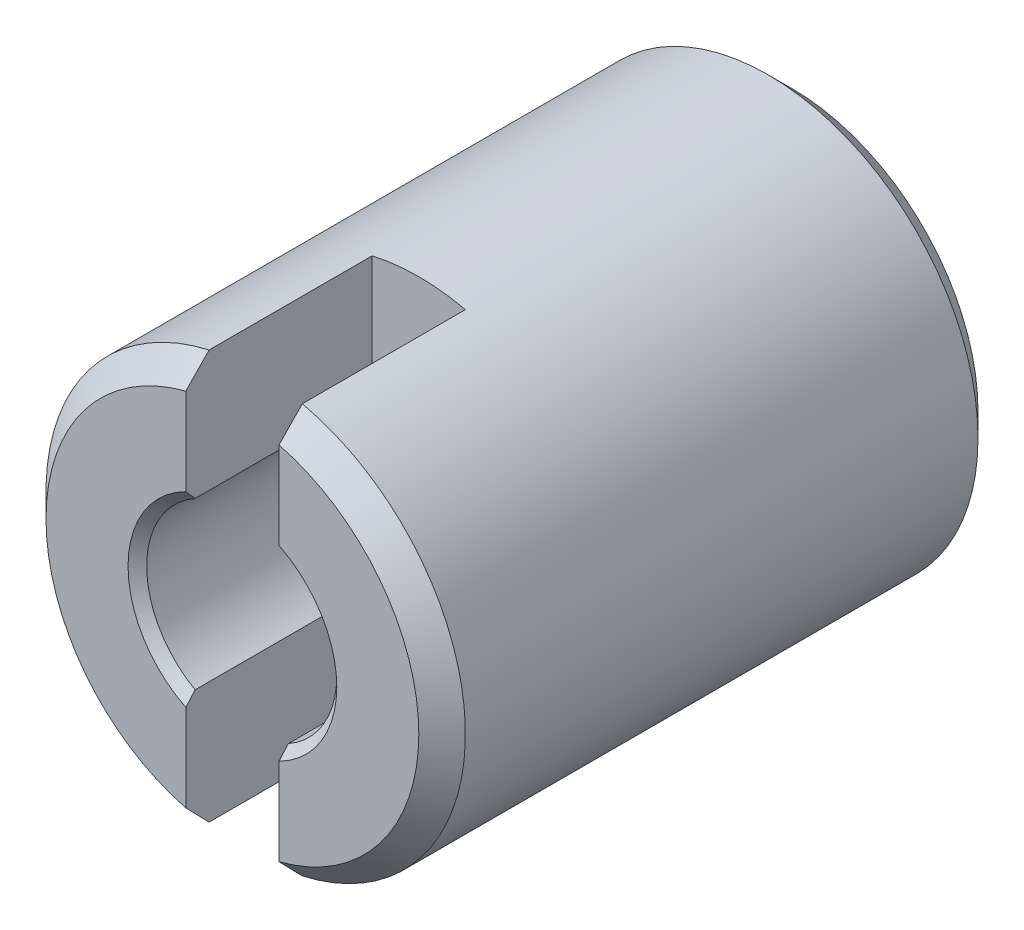
from build123d import *

# Parameters (mm, degrees)
SKETCH_1_R          = 2.25
EXTRUDE_1_DEPTH     = 6
SKETCH_2_R          = 1.02
CUT_EXTRUDE_1_DEPTH = 6
SKETCH_3_W          = 1
SKETCH_3_H          = 5
CUT_EXTRUDE_2_DEPTH = 2
CHAMFER_1_SIZE      = 0.25
CHAMFER_2_SIZE      = 0.25
CHAMFER_4_SIZE      = 0.25
CHAMFER_5_SIZE      = 0.1
CHAMFER_6_SIZE      = 0.1
CHAMFER_7_SIZE      = 0.1


with BuildPart() as part:
    # Эскиз1 → Бобышка-Вытянуть1 (new body)
    with BuildSketch(Plane.XY):
        Circle(SKETCH_1_R)
    extrude(amount=EXTRUDE_1_DEPTH)

    # Эскиз2 → Вырез-Вытянуть1 (cut)
    with BuildSketch(Plane.XY.offset(6)):
        Circle(SKETCH_2_R)
    extrude(amount=-CUT_EXTRUDE_1_DEPTH, mode=Mode.SUBTRACT)

    # Эскиз3 → Вырез-Вытянуть2 (cut)
    with BuildSketch(Plane.XY.offset(6)):
        Rectangle(SKETCH_3_W, SKETCH_3_H)
    extrude(amount=-CUT_EXTRUDE_2_DEPTH, mode=Mode.SUBTRACT)

    # Фаска1
    chamfer_1_edges = [part.edges().sort_by_distance(p)[0] for p in [
        (1.75890591, -1.40312152, 6),
    ]]
    chamfer(chamfer_1_edges, length=CHAMFER_1_SIZE)

    # Фаска2
    chamfer_2_edges = [part.edges().sort_by_distance(p)[0] for p in [
        (-2.25, 0, 6),
    ]]
    chamfer(chamfer_2_edges, length=CHAMFER_2_SIZE)

    # Фаска4
    chamfer_4_edges = [part.edges().sort_by_distance(p)[0] for p in [
        (-2.25, 0, 0),
    ]]
    chamfer(chamfer_4_edges, length=CHAMFER_4_SIZE)

    # Фаска5
    chamfer_5_edges = [part.edges().sort_by_distance(p)[0] for p in [
        (-1.02, 0, 0),
    ]]
    chamfer(chamfer_5_edges, length=CHAMFER_5_SIZE)

    # Фаска6
    chamfer_6_edges = [part.edges().sort_by_distance(p)[0] for p in [
        (0.880454428, -0.514975728, 6),
    ]]
    chamfer(chamfer_6_edges, length=CHAMFER_6_SIZE)

    # Фаска7
    chamfer_7_edges = [part.edges().sort_by_distance(p)[0] for p in [
        (-1.02, 0, 6),
    ]]
    chamfer(chamfer_7_edges, length=CHAMFER_7_SIZE)


solid = part.part
